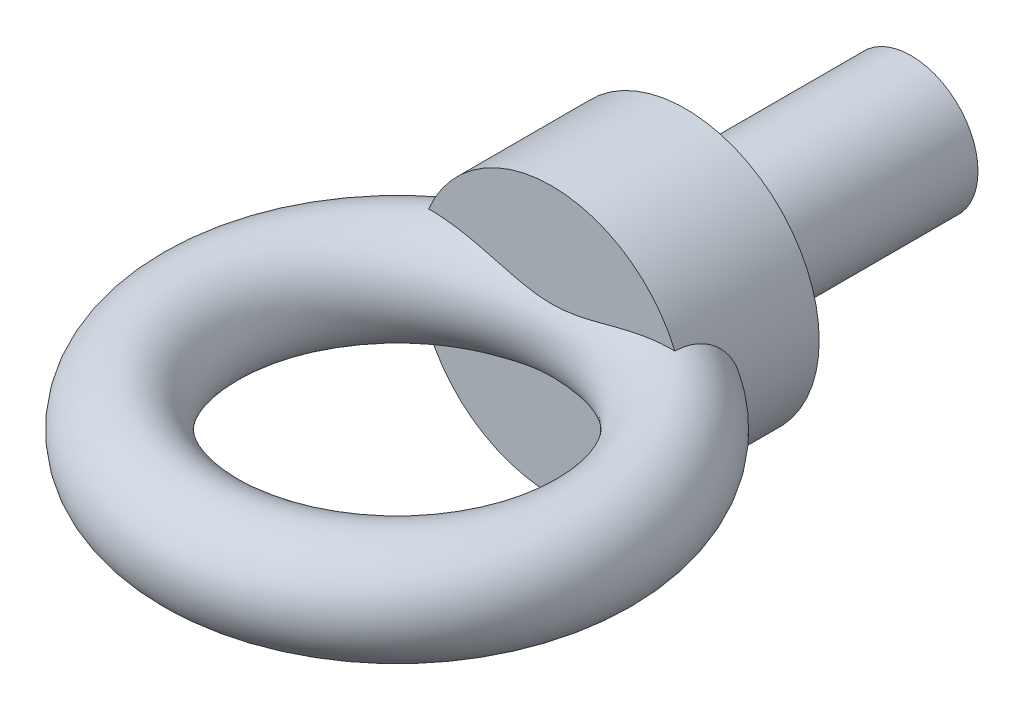
from build123d import *

# Parameters (mm, degrees)
SKETCH_1_R      = 8
EXTRUDE_1_DEPTH = 38
SKETCH_4_R      = 6.25
SKETCH_5_R      = 16
EXTRUDE_2_DEPTH = 16


with BuildPart() as part:
    # ｽｹｯﾁ1 → ﾎﾞｽ - 押し出し1 (new body)
    with BuildSketch(Plane.XY):
        Circle(SKETCH_1_R)
    extrude(amount=EXTRUDE_1_DEPTH)

    # ｽｲｰﾌﾟ1: sweep along a path in ｽｹｯﾁ3
    with BuildLine(Plane(origin=(0, 0, 0), x_dir=(1, 0, 0), z_dir=(0, 1, 0))) as sweep_1_path:
        CenterArc((0, -61.496723685), 23.496723685, 0, 360)
    # ｽｹｯﾁ4 → ｽｲｰﾌﾟ1 (sweep)
    with BuildSketch(Plane(origin=(0, 0, 0), x_dir=(0, 0, -1), z_dir=(1, 0, 0))):
        with Locations((-38, 0)):
            Circle(SKETCH_4_R)
    sweep(path=sweep_1_path.line)

    # ｽｹｯﾁ5 → ﾎﾞｽ - 押し出し2 (add)
    with BuildSketch(Plane(origin=(0, 0, 27), x_dir=(-1, 0, 0), z_dir=(0, 0, -1))):
        Circle(SKETCH_5_R)
    extrude(amount=-EXTRUDE_2_DEPTH)


solid = part.part
